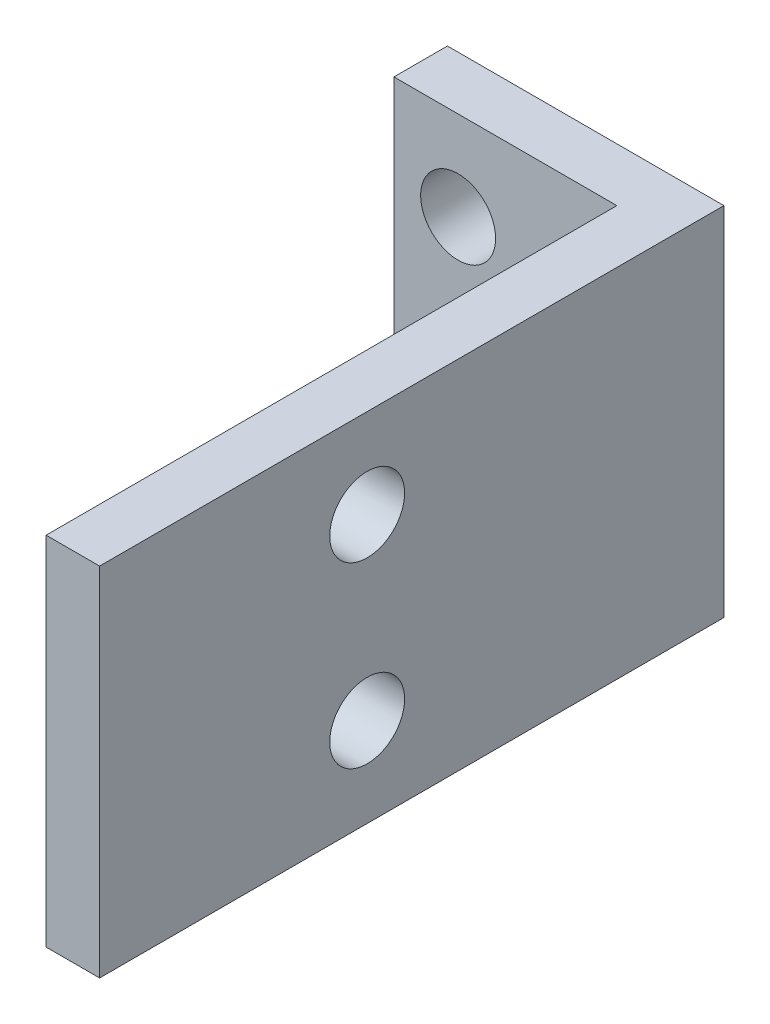
from build123d import *

# Parameters (mm, degrees)
SKETCH_1_W                  = 20
SKETCH_1_H                  = 35
EXTRUDE_1_DEPTH             = 15.5
SKETCH_2_W                  = 12.5
SKETCH_2_H                  = 32
CUT_EXTRUDE_1_DEPTH         = 49.176757882
HOLE_WIZARD_4_2_4_2_1_D     = 4.2
HOLE_WIZARD_4_2_4_2_1_DEPTH = 15.5
HOLE_WIZARD_4_2_4_2_2_D     = 4.2


with BuildPart() as part:
    # 草图1 → 凸台-拉伸1 (new body)
    with BuildSketch(Plane(origin=(20.5, 0, 0), x_dir=(0, -1, 0), z_dir=(-1, 0, 0))):
        with Locations((40, 7.5)):
            Rectangle(SKETCH_1_W, SKETCH_1_H)
    extrude(amount=-EXTRUDE_1_DEPTH)

    # 草图2 → 切除-拉伸1 (cut, through all)
    with BuildSketch(Plane.XZ.offset(50)):
        with Locations((26.75, 9)):
            Rectangle(SKETCH_2_W, SKETCH_2_H)
    extrude(amount=-CUT_EXTRUDE_1_DEPTH, mode=Mode.SUBTRACT)

    # Ø4.2 (4.2) 直径孔1
    with Locations(Plane(origin=(36, 0, 0), x_dir=(0, 0, -1), z_dir=(1, 0, 0))):
        with Locations((-10, -35), (-10, -45)):
            Hole(HOLE_WIZARD_4_2_4_2_1_D / 2, depth=HOLE_WIZARD_4_2_4_2_1_DEPTH)

    # Ø4.2 (4.2) 直径孔2 (through all)
    with Locations(Plane.XY.offset(-7)):
        with Locations((24.1, -45), (24.1, -35)):
            Hole(HOLE_WIZARD_4_2_4_2_2_D / 2)


solid = part.part
